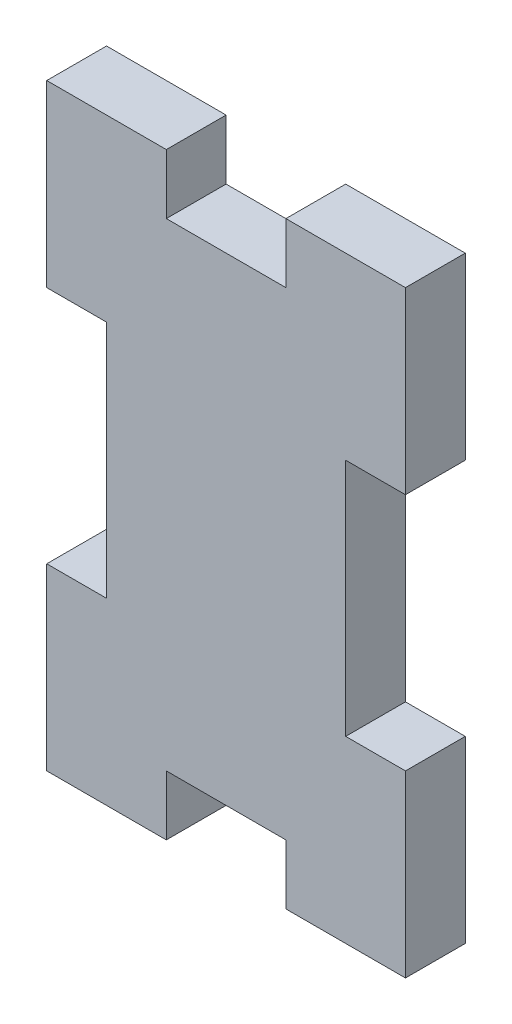
from build123d import *

# Parameters (mm, degrees)
BOSS_EXTRUDE1_DEPTH = 5


with BuildPart() as part:
    # Sketch1 → Boss-Extrude1 (new body)
    with BuildSketch(Plane.XY):
        Polygon((12.999000463, 15.515274598), (12.999000463, 5.515274598), (17.999000463, 5.515274598), (17.999000463, -14.484725402), (12.999000463, -14.484725402), (12.999000463, -24.484725402), (12.999000463, -29.484725402), (22.999000463, -29.484725402), (22.999000463, -24.484725402), (32.999000463, -24.484725402), (32.999000463, -29.484725402), (42.999000463, -29.484725402), (42.999000463, -24.484725402), (42.999000463, -14.484725402), (37.999000463, -14.484725402), (37.999000463, 5.515274598), (42.999000463, 5.515274598), (42.999000463, 15.515274598), (42.999000463, 20.515274598), (32.999000463, 20.515274598), (32.999000463, 15.515274598), (22.999000463, 15.515274598), (22.999000463, 20.515274598), (12.999000463, 20.515274598), align=None)
    extrude(amount=BOSS_EXTRUDE1_DEPTH)


solid = part.part
